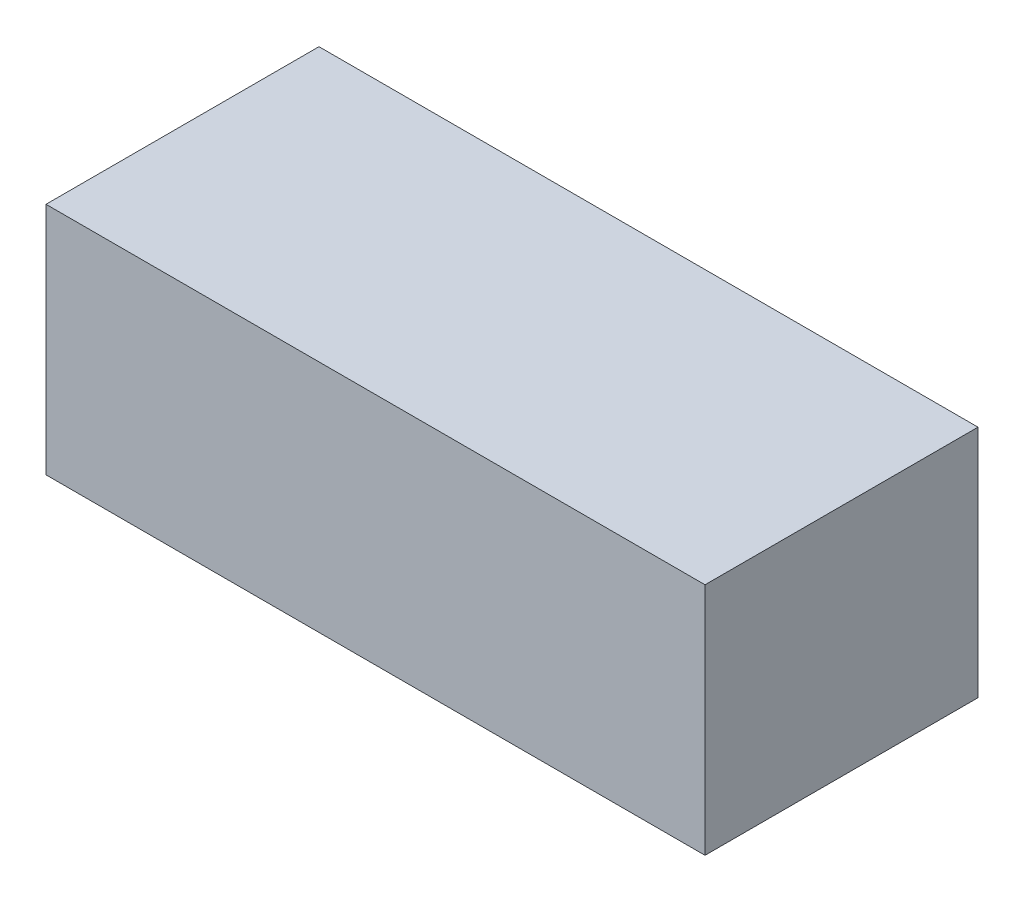
from build123d import *

# Parameters (mm, degrees)
SKETCH1_W           = 57.15
SKETCH1_H           = 23.6728
BOSS_EXTRUDE1_DEPTH = 10.16


with BuildPart() as part:
    # Sketch1 → Boss-Extrude1 (new, symmetric)
    with BuildSketch(Plane(origin=(0, 0, 0), x_dir=(1, 0, 0), z_dir=(0, 1, 0))):
        Rectangle(SKETCH1_W, SKETCH1_H)
    extrude(amount=BOSS_EXTRUDE1_DEPTH, both=True)


solid = part.part
